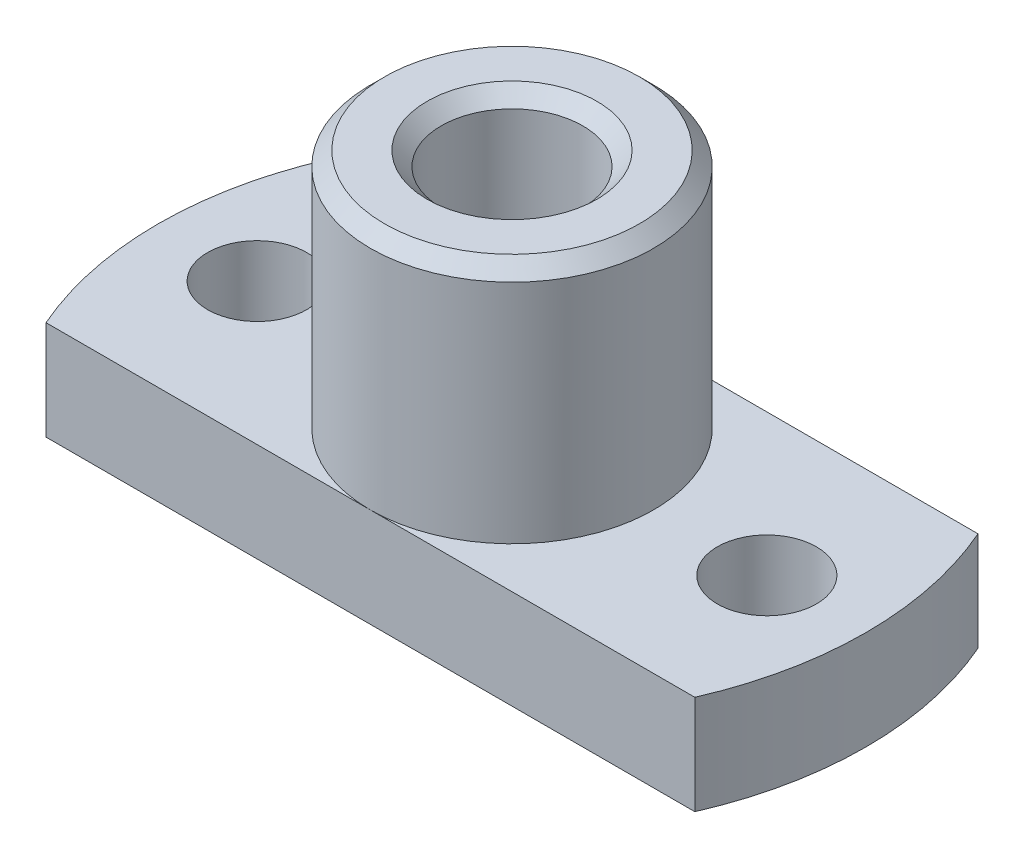
from build123d import *

# Parameters (mm, degrees)
EXTRUDE_1_DEPTH     = 3.5
SKETCH_2_R          = 5
EXTRUDE_2_DEPTH     = 8.5
SKETCH_3_R          = 2.5
CUT_EXTRUDE_1_DEPTH = 19.034688797
SKETCH_4_R          = 1.75
CUT_EXTRUDE_2_DEPTH = 16.921683328
CHAMFER_1_SIZE      = 0.5


with BuildPart() as part:
    # 草图1 → 凸台-拉伸1 (new body)
    with BuildSketch(Plane(origin=(0, 0, 0), x_dir=(1, 0, 0), z_dir=(0, 1, 0))):
        with BuildLine():
            ThreePointArc((-11.456439237, 5), (-12.236328912, 2.553870546), (-12.5, 0))
            Line((-12.5, 0), (12.5, 0))
            ThreePointArc((12.5, 0), (12.236328912, 2.553870546), (11.456439237, 5))
            Line((11.456439237, 5), (-11.456439237, 5))
        make_face()
        with BuildLine():
            Line((12.5, 0), (-12.5, 0))
            ThreePointArc((-12.5, 0), (-12.236328912, -2.553870546), (-11.456439237, -5))
            Line((-11.456439237, -5), (11.456439237, -5))
            ThreePointArc((11.456439237, -5), (12.236328912, -2.553870546), (12.5, 0))
        make_face()
    extrude(amount=EXTRUDE_1_DEPTH)

    # 草图2 → 凸台-拉伸2 (add)
    with BuildSketch(Plane(origin=(0, 3.5, 0), x_dir=(1, 0, 0), z_dir=(0, 1, 0))):
        with Locations(Location((0, 0, 0), (0, 0, 270))):
            Circle(SKETCH_2_R)
    extrude(amount=EXTRUDE_2_DEPTH)

    # 草图3 → 切除-拉伸1 (cut, through all)
    with BuildSketch(Plane(origin=(0, 12, 0), x_dir=(1, 0, 0), z_dir=(0, 1, 0))):
        with Locations(Location((0, 0, 0), (0, 0, 270))):
            Circle(SKETCH_3_R)
    extrude(amount=-CUT_EXTRUDE_1_DEPTH, mode=Mode.SUBTRACT)

    # 草图4 → 切除-拉伸2 (cut, through all)
    with BuildSketch(Plane(origin=(0, 3.5, 0), x_dir=(1, 0, 0), z_dir=(0, 1, 0))):
        with Locations(Location((-9, 0, 0), (0, 0, 270))):
            Circle(SKETCH_4_R)
        with Locations(Location((9, 0, 0), (0, 0, 90))):
            Circle(SKETCH_4_R)
    extrude(amount=-CUT_EXTRUDE_2_DEPTH, mode=Mode.SUBTRACT)

    # 倒角1
    chamfer_1_edges = [part.edges().sort_by_distance(p)[0] for p in [
        (0, 12, -5),
        (0, 12, -2.5),
    ]]
    chamfer(chamfer_1_edges, length=CHAMFER_1_SIZE)


solid = part.part
